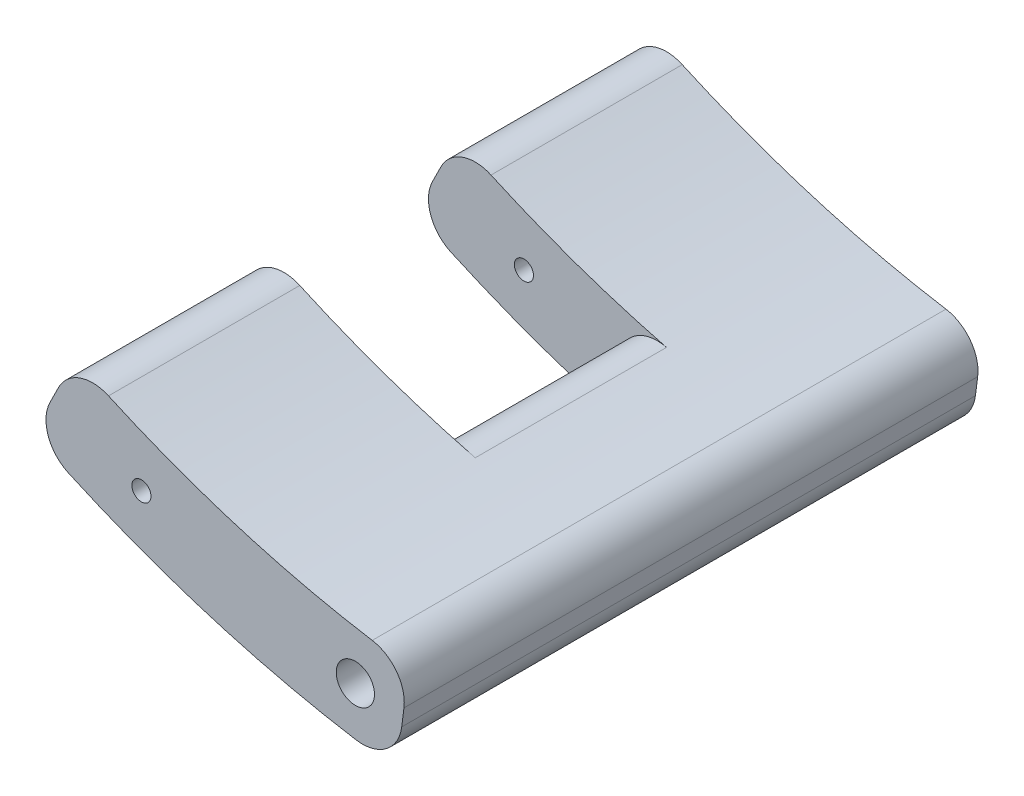
from build123d import *

# Parameters (mm, degrees)
BOSS_EXTRUDE1_DEPTH     = 30
SKETCH2_W               = 10
SKETCH2_H               = 10
CUT_EXTRUDE2_DEPTH      = 37.330733855
SKETCH3_R               = 0.5
CUT_EXTRUDE3_DEPTH      = 30
FILLET1_R               = 2
SKETCH4_W               = 30
SKETCH4_H               = 5
BOSS_EXTRUDE2_DEPTH     = 10
FILLET2_R               = 2
FILLET3_R               = 2
CUT_EXTRUDE4_DEPTH      = 80.110177146
SKETCH6_W               = 10
SKETCH6_H               = 6
SKETCH8_W               = 10
SKETCH8_H               = 2.121165988
CUT_EXTRUDE5_DEPTH      = 80.110177146
FILLET4_R               = 8
CUT_EXTRUDE6_DEPTH      = 80.110177146
CUT_EXTRUDE6_DEPTH_BACK = 50
SCALE1_SCALE            = 1.9329
SCALE2_SCALE            = 1.5
CUT_EXTRUDE7_DEPTH      = 134.461525953
CUT_EXTRUDE7_DEPTH_BACK = 134.461525953
SKETCH10_R              = 280.344567012
SKETCH10_R_2            = 173.961
FILLET5_R               = 6


with BuildPart() as part:
    # Sketch1 → Boss-Extrude1 (new body)
    with BuildSketch(Plane.XY):
        with BuildLine():
            Line((-24.447759697, -49.267707941), (-26.670283306, -53.746590482))
            ThreePointArc((-26.670283306, -53.746590482), (-17.396934794, -57.422527459), (-7.642718065, -59.511249866))
            Line((-7.642718065, -59.511249866), (-7.005824893, -54.551979044))
            ThreePointArc((-7.005824893, -54.551979044), (-15.947190228, -52.637316837), (-24.447759697, -49.267707941))
        make_face()
    extrude(amount=BOSS_EXTRUDE1_DEPTH)

    # Sketch2 → Cut-Extrude2 (cut, through all)
    with BuildSketch(Plane(origin=(-26.670283306, -53.746590482, 0), x_dir=(0, 0, -1), z_dir=(0.4445047217595844, 0.8957765080272169, 0))):
        with Locations((-15, -5)):
            Rectangle(SKETCH2_W, SKETCH2_H)
    extrude(amount=CUT_EXTRUDE2_DEPTH, mode=Mode.SUBTRACT)

    # Sketch3 → Cut-Extrude3 (cut)
    with BuildSketch(Plane.XY.offset(30)):
        with Locations((-20.983324138, -53.534569281)):
            Circle(SKETCH3_R)
    extrude(amount=-CUT_EXTRUDE3_DEPTH, mode=Mode.SUBTRACT)

    # Fillet1
    fillet1_edges = [part.edges().sort_by_distance(p)[0] for p in [
        (-26.670283306, -53.746590482, 5),
        (-24.447759697, -49.267707941, 5),
        (-15.082503417, -52.891569183, 15),
        (-17.339488899, -57.439900111, 15),
        (-26.670283306, -53.746590482, 25),
        (-24.447759697, -49.267707941, 25),
    ]]
    fillet(fillet1_edges, radius=FILLET1_R)

    # Sketch4 → Boss-Extrude2 (add)
    with BuildSketch(Plane(origin=(-7.515339431, -58.519395701, 0), x_dir=(0, 0, -1), z_dir=(-0.12737863441697944, -0.9918541644284535, 0))):
        with Locations((-15, -2.5)):
            Rectangle(SKETCH4_W, SKETCH4_H)
    extrude(amount=BOSS_EXTRUDE2_DEPTH)

    # Fillet2
    fillet2_edges = [part.edges().sort_by_distance(p)[0] for p in [
        (-12.575405439, -58.667360415, 15),
    ]]
    fillet(fillet2_edges, radius=FILLET2_R)

    # Fillet3
    fillet3_edges = [part.edges().sort_by_distance(p)[0] for p in [
        (-7.005824893, -54.551979044, 15),
    ]]
    fillet(fillet3_edges, radius=FILLET3_R)

    # Sketch5 → Cut-Extrude4 (cut, through all)
    with BuildSketch(Plane.XY.offset(30)):
        with BuildLine():
            ThreePointArc((-10.9503146, -65.639855348), (-11.509930999, -66.072093113), (-11.077693234, -66.631709513))
            Line((-11.077693234, -66.631709513), (-10.9503146, -65.639855348))
        make_face()
        with BuildLine():
            Line((-10.9503146, -65.639855348), (-11.077693234, -66.631709513))
            ThreePointArc((-11.077693234, -66.631709513), (-10.683734829, -66.51117866), (-10.514003917, -66.135782431))
            ThreePointArc((-10.514003917, -66.135782431), (-10.638607687, -65.805513342), (-10.9503146, -65.639855348))
        make_face()
    extrude(amount=-CUT_EXTRUDE4_DEPTH, mode=Mode.SUBTRACT)

    # Cut-Sweep1: sweep along a path in Sketch7
    with BuildLine(Plane.XY) as cut_sweep1_path:
        Line((-8.024853968, -62.486812359), (-12.806249613, -60.46486559))
    # Sketch6 → Cut-Sweep1 (sweep, cut)
    with BuildSketch(Plane(origin=(0, 0, 0), x_dir=(0, 0, -1), z_dir=(0.9918541644284535, -0.1273786344169795, 0))):
        with Locations((-15, -66)):
            Rectangle(SKETCH6_W, SKETCH6_H)
    sweep(path=cut_sweep1_path.line, mode=Mode.SUBTRACT)

    # Sketch8 → Cut-Extrude5 (cut, through all)
    with BuildSketch(Plane(origin=(0, 0, 0), x_dir=(0, 0, -1), z_dir=(0.9918541644284535, -0.1273786344169795, 0))):
        with Locations((-15, -67.939417006)):
            Rectangle(SKETCH8_W, SKETCH8_H)
    extrude(amount=-CUT_EXTRUDE5_DEPTH, mode=Mode.SUBTRACT)

    # Fillet4
    fillet4_edges = [part.edges().sort_by_distance(p)[0] for p in [
        (-12.806249613, -60.46486559, 15),
    ]]
    fillet(fillet4_edges, radius=FILLET4_R)

    # Sketch9 → Cut-Extrude6 (cut, two sides: drawn at the far end of the back side and taken through both)
    with BuildSketch(Plane(origin=(0, 0, 0), x_dir=(-1, 0, 0), z_dir=(0, 0, -1)).offset(-CUT_EXTRUDE6_DEPTH_BACK)):
        with BuildLine():
            ThreePointArc((10.780840063, -56.480292913), (8.989884423, -56.068817625), (9.924359498, -57.651091416))
            Line((9.924359498, -57.651091416), (9.796980863, -56.659237252))
            ThreePointArc((9.796980863, -56.659237252), (10.28929948, -56.571903947), (10.780840063, -56.480292913))
        make_face()
        with BuildLine():
            Line((9.796980863, -56.659237252), (9.924359498, -57.651091416))
            ThreePointArc((9.924359498, -57.651091416), (10.547773323, -57.319775428), (10.796980863, -56.659237252))
            ThreePointArc((10.796980863, -56.659237252), (10.792937489, -56.569401844), (10.780840063, -56.480292913))
            ThreePointArc((10.780840063, -56.480292913), (10.28929948, -56.571903947), (9.796980863, -56.659237252))
        make_face()
    extrude(amount=CUT_EXTRUDE6_DEPTH + CUT_EXTRUDE6_DEPTH_BACK, mode=Mode.SUBTRACT)


with BuildPart() as part_1:
    # Scale1: scaled about (-14.187636467, -57.651950404, 15)
    add(part.part.scale(SCALE1_SCALE).moved(Location((13.23564606, 53.783504532, -13.9935))))


with BuildPart() as part_2:
    # Scale2: scaled about (-14.187636468, -57.651950404, 15)
    add(part_1.part.scale(SCALE2_SCALE).moved(Location((7.093818234, 28.825975202, -7.5))))

    # Sketch10 → Cut-Extrude7 (cut, two sides: drawn at the far end of the back side and taken through both)
    with BuildSketch(Plane.XY.offset(58.49025).offset(-CUT_EXTRUDE7_DEPTH_BACK)):
        with Locations((26.947287324, 109.501231999)):
            Circle(SKETCH10_R)
        with Locations((26.947287324, 109.501231999)):
            Circle(SKETCH10_R_2, mode=Mode.SUBTRACT)
    extrude(amount=CUT_EXTRUDE7_DEPTH + CUT_EXTRUDE7_DEPTH_BACK, mode=Mode.SUBTRACT)

    # Fillet5
    fillet5_edges = [part_2.edges().sort_by_distance(p)[0] for p in [
        (4.788372702, -63.042710299, 15),
    ]]
    fillet(fillet5_edges, radius=FILLET5_R)


solid = part_2.part
